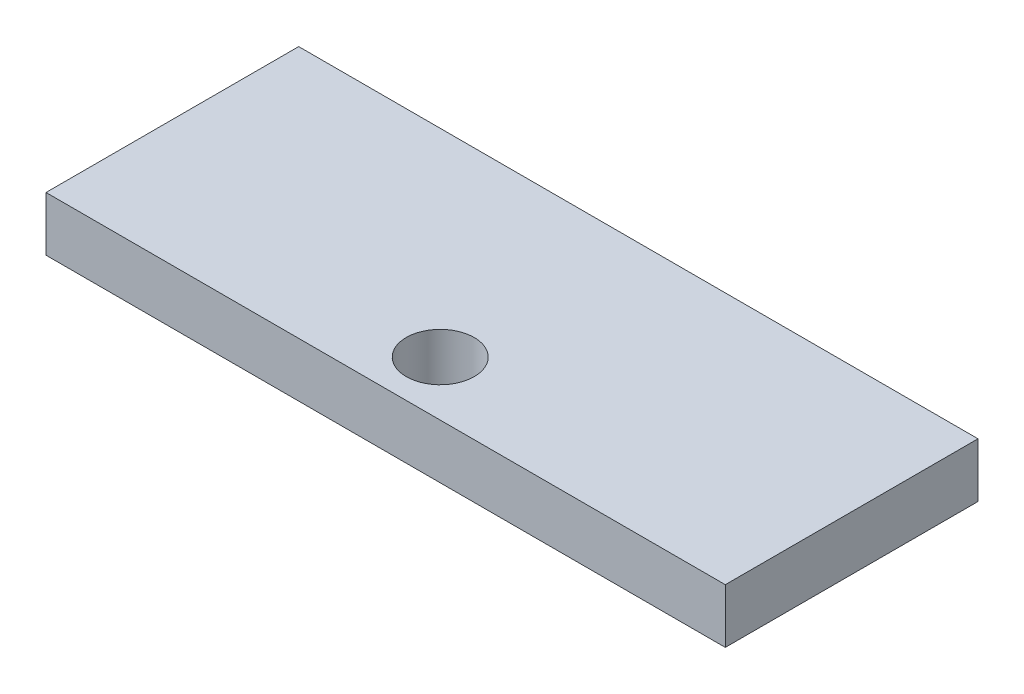
from build123d import *

# Parameters (mm, degrees)
SKETCH1_W           = 25
SKETCH1_H           = 9.5
SKETCH1_R           = 1.25
BOSS_EXTRUDE1_DEPTH = 2
CHAMFER1_SIZE       = 0.2


with BuildPart() as part:
    # Sketch1 → Boss-Extrude1 (new body)
    with BuildSketch(Plane(origin=(0, 0, 0), x_dir=(1, 0, 0), z_dir=(0, 1, 0))):
        Rectangle(SKETCH1_W, SKETCH1_H)
        with Locations(Location((0, -2.741510653, 0), (0, 0, 270))):
            Circle(SKETCH1_R, mode=Mode.SUBTRACT)
    extrude(amount=BOSS_EXTRUDE1_DEPTH)

    # Chamfer1
    chamfer1_edges = [part.edges().sort_by_distance(p)[0] for p in [
        (0, 2, -4.75),
        (0, 0, -4.75),
        (-12.5, 1, -4.75),
        (12.5, 1, -4.75),
    ]]
    chamfer(chamfer1_edges, length=CHAMFER1_SIZE)


solid = part.part
